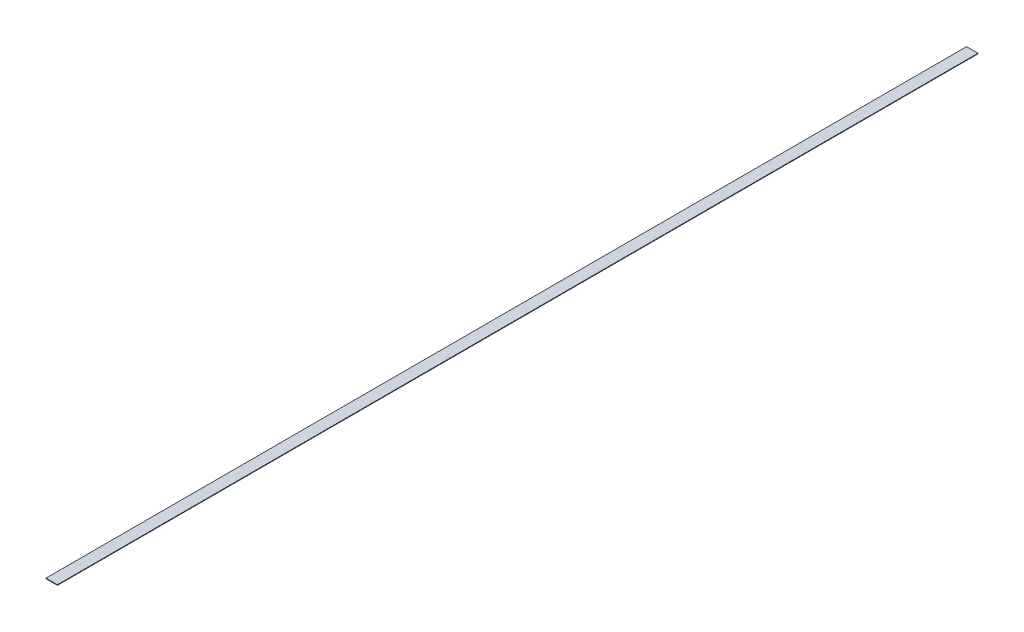
from build123d import *

# Parameters (mm, degrees)
SKETCH_1_W      = 20
SKETCH_1_H      = 1612.451549659
EXTRUDE_1_DEPTH = 1


with BuildPart() as part:
    # 草图1 → 凸台-拉伸1 (new body)
    with BuildSketch(Plane(origin=(0, 0, 0), x_dir=(1, 0, 0), z_dir=(0, 1, 0))):
        with Locations((1.24940883, 0.937056622)):
            Rectangle(SKETCH_1_W, SKETCH_1_H)
    extrude(amount=EXTRUDE_1_DEPTH)


solid = part.part
